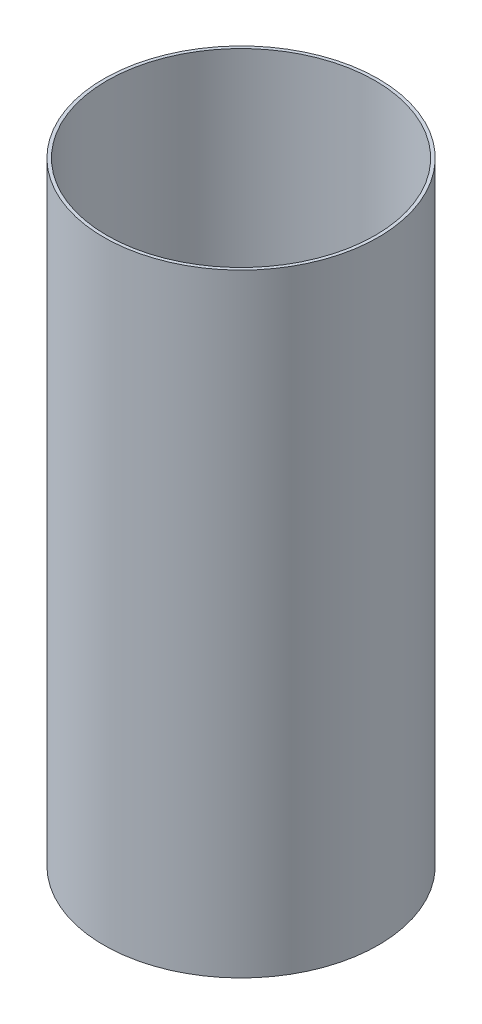
from build123d import *

# Parameters (mm, degrees)
SKETCH1_R           = 68.2625
SKETCH1_R_2         = 66.675
BOSS_EXTRUDE1_DEPTH = 304.8


with BuildPart() as part:
    # Sketch1 → Boss-Extrude1 (new body)
    with BuildSketch(Plane(origin=(0, 0, 0), x_dir=(1, 0, 0), z_dir=(0, 1, 0))):
        with Locations(Location((0, 0, 0), (0, 0, 90))):
            Circle(SKETCH1_R)
        with Locations(Location((0, 0, 0), (0, 0, 90))):
            Circle(SKETCH1_R_2, mode=Mode.SUBTRACT)
    extrude(amount=BOSS_EXTRUDE1_DEPTH)


solid = part.part
